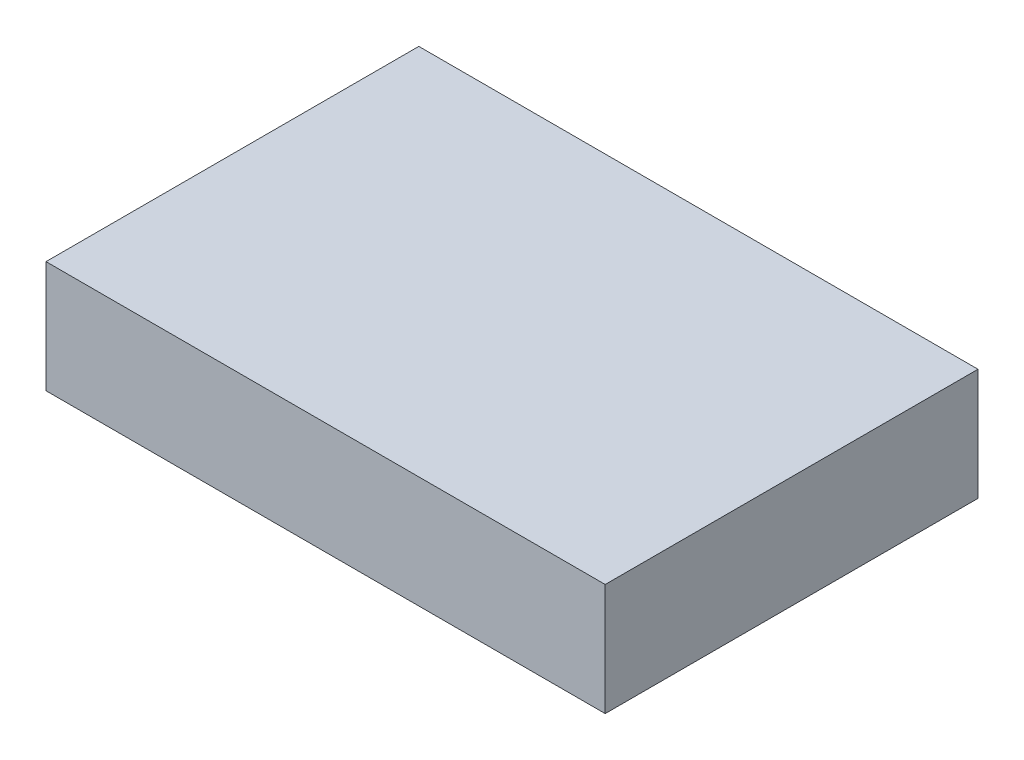
from build123d import *

# Parameters (mm, degrees)
SKETCH1_W           = 60
SKETCH1_H           = 40
BOSS_EXTRUDE1_DEPTH = 12


with BuildPart() as part:
    # Sketch1 → Boss-Extrude1 (new body)
    with BuildSketch(Plane(origin=(0, 0, 0), x_dir=(1, 0, 0), z_dir=(0, 1, 0))):
        with Locations((30, 20)):
            Rectangle(SKETCH1_W, SKETCH1_H)
    extrude(amount=BOSS_EXTRUDE1_DEPTH)


solid = part.part
